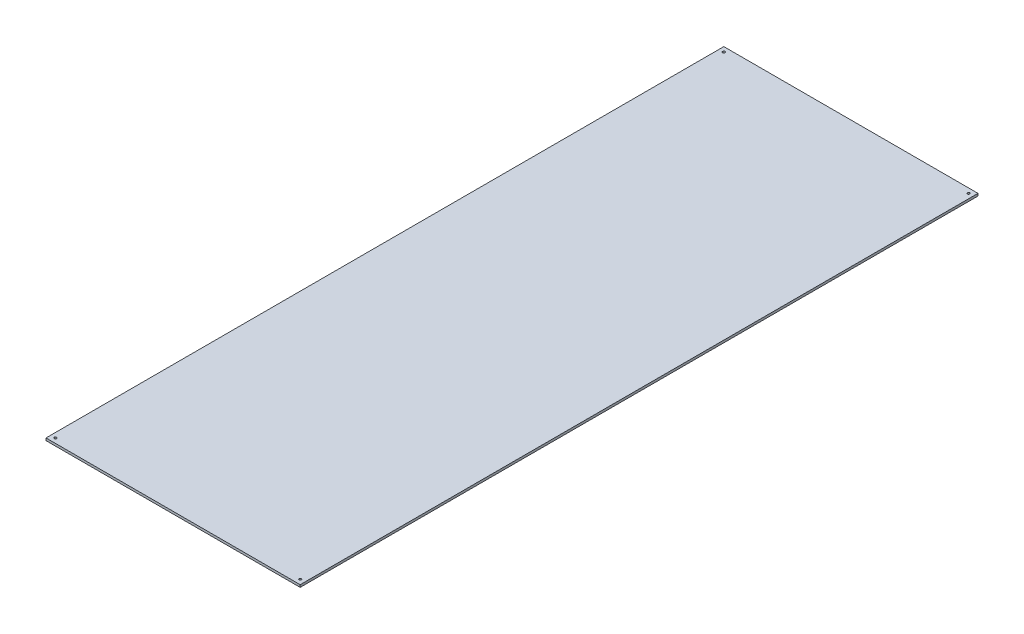
from build123d import *

# Parameters (mm, degrees)
SKETCH1_W           = 685.8
SKETCH1_H           = 1828.8
BOSS_EXTRUDE1_DEPTH = 6.35
SKETCH2_R           = 3.175
CUT_EXTRUDE1_DEPTH  = 977.600272629


with BuildPart() as part:
    # Sketch1 → Boss-Extrude1 (new body)
    with BuildSketch(Plane(origin=(0, 0, 0), x_dir=(1, 0, 0), z_dir=(0, 1, 0))):
        Rectangle(SKETCH1_W, SKETCH1_H)
    extrude(amount=BOSS_EXTRUDE1_DEPTH)

    # Sketch2 → Cut-Extrude1 (cut, through all)
    with BuildSketch(Plane(origin=(0, 6.35, 0), x_dir=(1, 0, 0), z_dir=(0, 1, 0))):
        with Locations(Location((330.2, -901.7, 0), (0, 0, 270))):
            Circle(SKETCH2_R)
        with Locations(Location((-330.2, -901.7, 0), (0, 0, 270))):
            Circle(SKETCH2_R)
        with Locations(Location((330.2, 901.7, 0), (0, 0, 270))):
            Circle(SKETCH2_R)
        with Locations(Location((-330.2, 901.7, 0), (0, 0, 270))):
            Circle(SKETCH2_R)
    extrude(amount=-CUT_EXTRUDE1_DEPTH, mode=Mode.SUBTRACT)


solid = part.part
